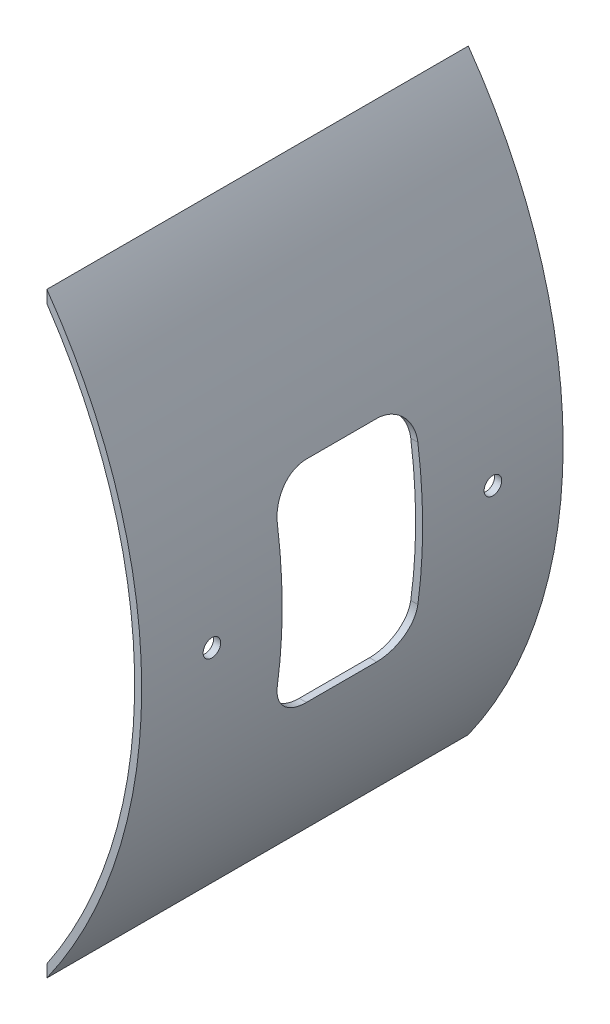
from build123d import *

# Parameters (mm, degrees)
BOSS_EXTRU_1_DEPTH                = 120
DIAM_TRE_DU_PER_AGE_5_0_5_1_D     = 5
DIAM_TRE_DU_PER_AGE_5_0_5_1_DEPTH = 60
DIAM_TRE_DU_PER_AGE_5_0_5_1_TIP   = 1.502151548
ENL_V_MAT_EXTRU_2_DEPTH           = 208.889393843


with BuildPart() as part:
    # Esquisse1 → Boss.-Extru.1 (new body)
    with BuildSketch(Plane.XY):
        with BuildLine():
            Line((120, 84.905830189), (120, 81.39410298))
            ThreePointArc((120, 81.39410298), (145, 0), (120, -81.39410298))
            Line((120, -81.39410298), (120, -84.905830189))
            ThreePointArc((120, -84.905830189), (147, 0), (120, 84.905830189))
        make_face()
    extrude(amount=BOSS_EXTRU_1_DEPTH)

    # Diamètre du perçage Ø5.0 (5)1
    with Locations(Plane(origin=(147, 0, 20), x_dir=(0, 1, 0), z_dir=(1, 0, 0))):
        with Locations((0, 0), (0, 80)):
            Hole(DIAM_TRE_DU_PER_AGE_5_0_5_1_D / 2, depth=DIAM_TRE_DU_PER_AGE_5_0_5_1_DEPTH)
            with Locations((0, 0, -(DIAM_TRE_DU_PER_AGE_5_0_5_1_DEPTH + DIAM_TRE_DU_PER_AGE_5_0_5_1_TIP / 2))):  # 118° drill point
                Cone(0, DIAM_TRE_DU_PER_AGE_5_0_5_1_D / 2, DIAM_TRE_DU_PER_AGE_5_0_5_1_TIP, mode=Mode.SUBTRACT)

    # Esquisse3 → Enlèv. mat.-Extru.2 (cut, through all)
    with BuildSketch(Plane(origin=(0, 0, 0), x_dir=(0, 0, -1), z_dir=(1, 0, 0))):
        with BuildLine():
            Line((-70, 30), (-50, 30))
            ThreePointArc((-50, 30), (-42.928932188, 27.071067812), (-40, 20))
            Line((-40, 20), (-40, -20))
            ThreePointArc((-40, -20), (-42.928932188, -27.071067812), (-50, -30))
            Line((-50, -30), (-70, -30))
            ThreePointArc((-70, -30), (-77.071067812, -27.071067812), (-80, -20))
            Line((-80, -20), (-80, 20))
            ThreePointArc((-80, 20), (-77.071067812, 27.071067812), (-70, 30))
        make_face()
    extrude(amount=ENL_V_MAT_EXTRU_2_DEPTH, mode=Mode.SUBTRACT)


solid = part.part
